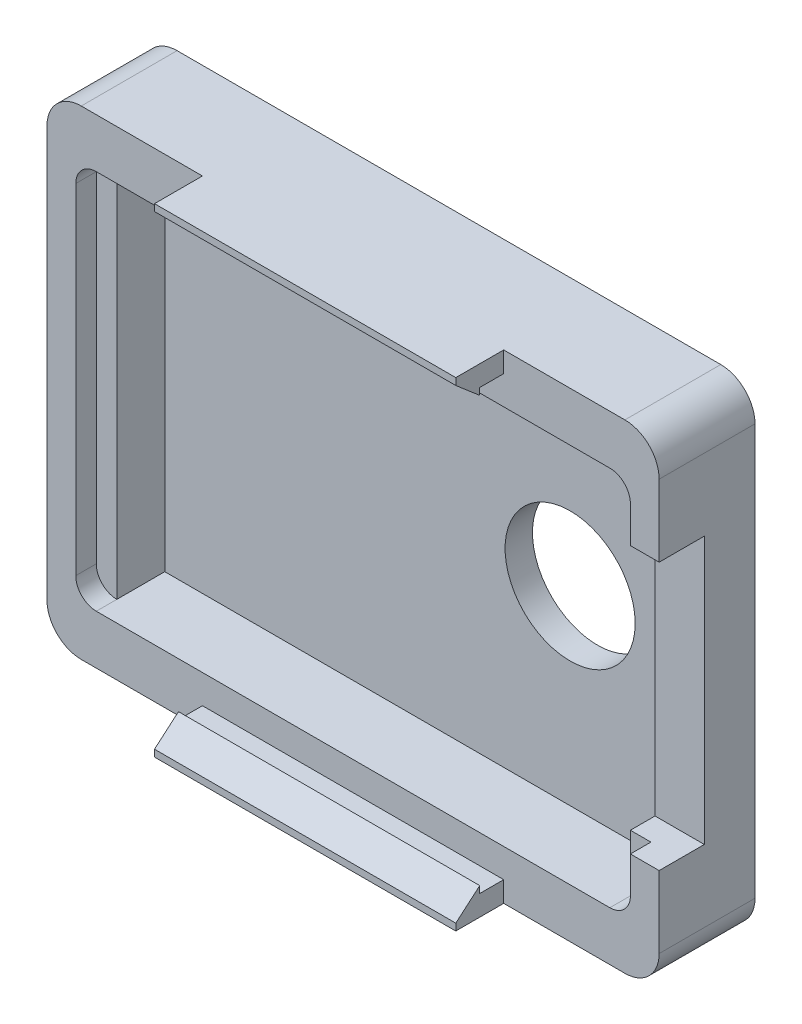
from build123d import *

# Parameters (mm, degrees)
CROQUIS1_W              = 44.7
CROQUIS1_H              = 35
CROQUIS1_R              = 4.75
CROQUIS1_W_2            = 5
CROQUIS1_H_2            = 5
SALIENTE_EXTRUIR1_DEPTH = 2
CROQUIS2_W              = 44.7
CROQUIS2_H              = 35
CROQUIS2_W_2            = 40.5
CROQUIS2_H_2            = 27.8
SALIENTE_EXTRUIR2_DEPTH = 5
REDONDEO1_R             = 1.5
REDONDEO2_R             = 2.5
SALIENTE_EXTRUIR3_START = 3.5
SALIENTE_EXTRUIR3_DEPTH = 3.5
CROQUIS5_W              = 3.3
CROQUIS5_H              = 19.5
CORTAR_EXTRUIR1_DEPTH   = 5.5
CROQUIS6_W              = 22
CROQUIS6_H              = 2
SALIENTE_EXTRUIR4_DEPTH = 3.5
CROQUIS7_W              = 1.75
CROQUIS7_H              = 0.5
CORTAR_EXTRUIR2_DEPTH   = 40.098881058


with BuildPart() as part:
    # Croquis1 → Saliente-Extruir1 (new body)
    with BuildSketch(Plane.XY):
        Rectangle(CROQUIS1_W, CROQUIS1_H)
        with Locations((10.85, 0)):
            Circle(CROQUIS1_R, mode=Mode.SUBTRACT)
        with Locations((-8.85, 11.5)):
            Rectangle(CROQUIS1_W_2, CROQUIS1_H_2, mode=Mode.SUBTRACT)
    extrude(amount=SALIENTE_EXTRUIR1_DEPTH)

    # Croquis2 → Saliente-Extruir2 (add)
    with BuildSketch(Plane.XY.offset(2)):
        Rectangle(CROQUIS2_W, CROQUIS2_H)
        Rectangle(CROQUIS2_W_2, CROQUIS2_H_2, mode=Mode.SUBTRACT)
    extrude(amount=SALIENTE_EXTRUIR2_DEPTH)

    # Redondeo1
    redondeo1_edges = [part.edges().sort_by_distance(p)[0] for p in [
        (20.25, 13.9, 4.5),
        (-20.25, 13.9, 4.5),
        (-20.25, -13.9, 4.5),
        (20.25, -13.9, 4.5),
    ]]
    fillet(redondeo1_edges, radius=REDONDEO1_R)

    # Redondeo2
    redondeo2_edges = [part.edges().sort_by_distance(p)[0] for p in [
        (-22.35, -17.5, 3.5),
        (-22.35, 17.5, 3.5),
        (22.35, 17.5, 3.5),
        (22.35, -17.5, 3.5),
    ]]
    fillet(redondeo2_edges, radius=REDONDEO2_R)

    # Croquis4 → Saliente-Extruir3 (add)
    with BuildSketch(Plane.XY.offset(2).offset(SALIENTE_EXTRUIR3_START)):
        with BuildLine():
            Line((-20.25, 12.4), (-20.25, -12.4))
            ThreePointArc((-20.25, -12.4), (-19.810660172, -13.460660172), (-18.75, -13.9))
            Line((-18.75, -13.9), (-18.75, 13.9))
            ThreePointArc((-18.75, 13.9), (-19.810660172, 13.460660172), (-20.25, 12.4))
        make_face()
        with BuildLine():
            Line((20.25, -12.4), (20.25, 12.4))
            ThreePointArc((20.25, 12.4), (19.810660172, 13.460660172), (18.75, 13.9))
            Line((18.75, 13.9), (18.75, -13.9))
            ThreePointArc((18.75, -13.9), (19.810660172, -13.460660172), (20.25, -12.4))
        make_face()
    extrude(amount=-SALIENTE_EXTRUIR3_DEPTH)

    # Croquis5 → Cortar-Extruir1 (cut)
    with BuildSketch(Plane(origin=(22.35, 0, 0), x_dir=(0, 0, -1), z_dir=(1, 0, 0))):
        with Locations((-5.35, 0)):
            Rectangle(CROQUIS5_W, CROQUIS5_H)
    extrude(amount=-CORTAR_EXTRUIR1_DEPTH, mode=Mode.SUBTRACT)

    # Croquis6 → Saliente-Extruir4 (add)
    with BuildSketch(Plane.XY.offset(7)):
        with Locations((0, -16.5)):
            Rectangle(CROQUIS6_W, CROQUIS6_H)
        with Locations((0, 16.5)):
            Rectangle(CROQUIS6_W, CROQUIS6_H)
    extrude(amount=SALIENTE_EXTRUIR4_DEPTH)

    # Croquis7 → Cortar-Extruir2 (cut, through all)
    with BuildSketch(Plane(origin=(11, 0, 0), x_dir=(0, 0, -1), z_dir=(1, 0, 0))):
        Polygon((-10.5, -15.5), (-10.5, -17), (-8.75, -15.5), align=None)
        Polygon((-8.75, 15.5), (-10.5, 17), (-10.5, 15.5), align=None)
        with Locations((-7.875, 15.75)):
            Rectangle(CROQUIS7_W, CROQUIS7_H)
        with Locations((-7.875, -15.75)):
            Rectangle(CROQUIS7_W, CROQUIS7_H)
    extrude(amount=-CORTAR_EXTRUIR2_DEPTH, mode=Mode.SUBTRACT)


solid = part.part
